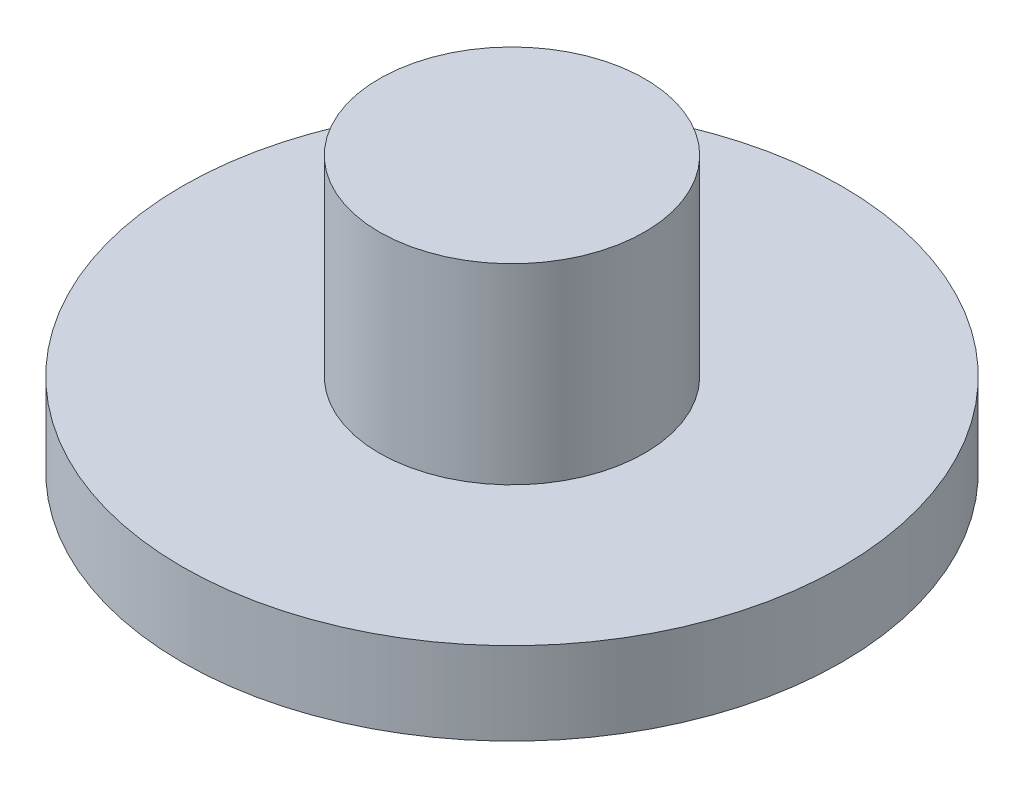
from build123d import *

# Parameters (mm, degrees)
SKETCH1_R           = 7.575
BOSS_EXTRUDE1_DEPTH = 1.9
SKETCH2_R           = 3.05
BOSS_EXTRUDE2_DEPTH = 4.4


with BuildPart() as part:
    # Sketch1 → Boss-Extrude1 (new body)
    with BuildSketch(Plane(origin=(0, 0, 0), x_dir=(1, 0, 0), z_dir=(0, 1, 0))):
        with Locations(Location((0, 0, 0), (0, 0, 90))):
            Circle(SKETCH1_R)
    extrude(amount=BOSS_EXTRUDE1_DEPTH)

    # Sketch2 → Boss-Extrude2 (add)
    with BuildSketch(Plane(origin=(0, 1.9, 0), x_dir=(1, 0, 0), z_dir=(0, 1, 0))):
        with Locations(Location((0, 0, 0), (0, 0, 270))):
            Circle(SKETCH2_R)
    extrude(amount=BOSS_EXTRUDE2_DEPTH)


solid = part.part
